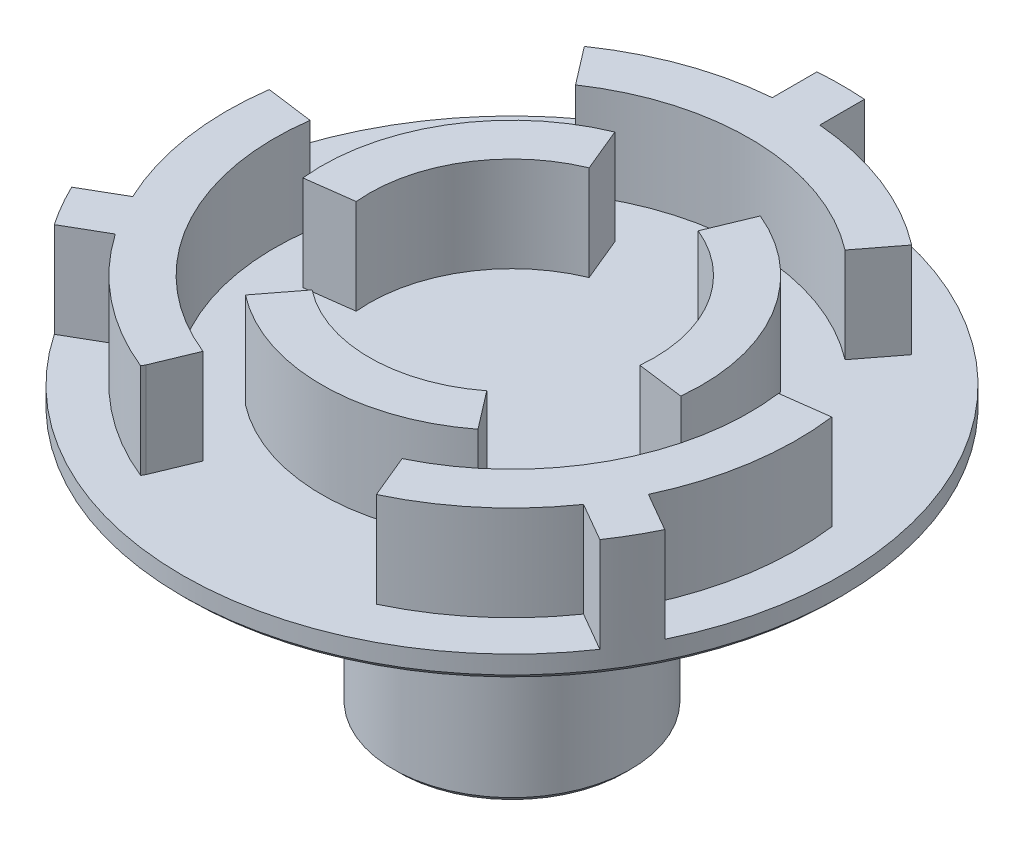
from build123d import *

# Parameters (mm, degrees)
SKETCH1_R           = 44.05249
BOSS_EXTRUDE1_DEPTH = 3.175
SKETCH2_R           = 15.875
BOSS_EXTRUDE2_DEPTH = 34.12998
SKETCH3_R           = 25.4
SKETCH3_R_2         = 19.05
BOSS_EXTRUDE3_DEPTH = 12.7
CUT_EXTRUDE2_DEPTH  = 73.614773175
CIRPATTERN1_COUNT   = 3
SKETCH5_R           = 38.1
SKETCH5_R_2         = 31.75
BOSS_EXTRUDE5_DEPTH = 12.7
CUT_EXTRUDE4_DEPTH  = 12.7
CIRPATTERN3_COUNT   = 3
BOSS_EXTRUDE6_DEPTH = 12.7
CIRPATTERN4_COUNT   = 3
SKETCH8_R           = 12.7
CUT_EXTRUDE5_DEPTH  = 34.12998
CHAMFER1_SIZE       = 0.762


with BuildPart() as part:
    # Sketch1 → Boss-Extrude1 (new body)
    with BuildSketch(Plane(origin=(0, 0, 0), x_dir=(1, 0, 0), z_dir=(0, 1, 0))):
        with Locations(Location((0, 0, 0), (0, 0, 270))):
            Circle(SKETCH1_R)
    extrude(amount=BOSS_EXTRUDE1_DEPTH)

    # Sketch2 → Boss-Extrude2 (add)
    with BuildSketch(Plane.XZ):
        with Locations(Location((0, 0, 0), (0, 0, 270))):
            Circle(SKETCH2_R)
    extrude(amount=BOSS_EXTRUDE2_DEPTH)

    # Sketch3 → Boss-Extrude3 (add)
    with BuildSketch(Plane(origin=(0, 3.175, 0), x_dir=(1, 0, 0), z_dir=(0, 1, 0))):
        with Locations(Location((0, 0, 0), (0, 0, 270))):
            Circle(SKETCH3_R)
        with Locations(Location((0, 0, 0), (0, 0, 270))):
            Circle(SKETCH3_R_2, mode=Mode.SUBTRACT)
    extrude(amount=BOSS_EXTRUDE3_DEPTH)

    # Sketch4 → Cut-Extrude2 (cut, through all)
    with BuildSketch(Plane(origin=(0, 3.175, 0), x_dir=(1, 0, 0), z_dir=(0, 1, 0))):
        Polygon((0, 0), (11.462134213, 27.672039871), (-12.066850466, 29.13195405), align=None)
    cut_extrude2 = extrude(amount=CUT_EXTRUDE2_DEPTH, mode=Mode.SUBTRACT)

    # CirPattern1: Cut-Extrude2 ×3 about axis
    cirpattern1_axis = Axis((0, 0, -0.454253878), (0, 1, 0))
    for i in range(1, CIRPATTERN1_COUNT):
        add(cut_extrude2.rotate(cirpattern1_axis, i * 360 / CIRPATTERN1_COUNT), mode=Mode.SUBTRACT)

    # Sketch5 → Boss-Extrude5 (add)
    with BuildSketch(Plane(origin=(0, 3.175, 0), x_dir=(1, 0, 0), z_dir=(0, 1, 0))):
        with Locations(Location((0, 0, 0), (0, 0, 270))):
            Circle(SKETCH5_R)
        with Locations(Location((0, 0, 0), (0, 0, 270))):
            Circle(SKETCH5_R_2, mode=Mode.SUBTRACT)
    extrude(amount=BOSS_EXTRUDE5_DEPTH)

    # Sketch6 → Cut-Extrude4 (cut)
    with BuildSketch(Plane(origin=(0, 15.875, 0), x_dir=(1, 0, 0), z_dir=(0, 1, 0))):
        Polygon((24.518856113, 31.953595399), (30.847960217, 40.201844455), (52.890000535, 5.212460302), (39.592566776, 5.212460302), (30.847960217, 4.061211008), (18.173239697, 23.68382708), align=None)
    cut_extrude4 = extrude(amount=-CUT_EXTRUDE4_DEPTH, mode=Mode.SUBTRACT)

    # CirPattern3: Cut-Extrude4 ×3 about axis
    cirpattern3_axis = Axis((1.188980204, 0, -0.687015275), (0, 1, 0))
    for i in range(1, CIRPATTERN3_COUNT):
        add(cut_extrude4.rotate(cirpattern3_axis, i * 360 / CIRPATTERN3_COUNT), mode=Mode.SUBTRACT)

    # Sketch7 → Boss-Extrude6 (add)
    with BuildSketch(Plane(origin=(0, 3.175, 0), x_dir=(1, 0, 0), z_dir=(0, 1, 0))):
        with BuildLine():
            Line((3.175, 35.86061982), (3.175, 43.937924965))
            ThreePointArc((3.175, 43.937924965), (0, 44.05249), (-3.175, 43.937924965))
            Line((-3.175, 43.937924965), (-3.175, 35.86061982))
            ThreePointArc((-3.175, 35.86061982), (0, 36.000898307), (3.175, 35.86061982))
        make_face()
    boss_extrude6 = extrude(amount=BOSS_EXTRUDE6_DEPTH)

    # CirPattern4: Boss-Extrude6 ×3 about axis
    cirpattern4_axis = Axis((0, 0, 0), (0, 1, 0))
    for i in range(1, CIRPATTERN4_COUNT):
        add(boss_extrude6.rotate(cirpattern4_axis, i * 360 / CIRPATTERN4_COUNT))

    # Sketch8 → Cut-Extrude5 (cut)
    with BuildSketch(Plane.XZ.offset(34.12998)):
        with Locations(Location((0, 0, 0), (0, 0, 270))):
            Circle(SKETCH8_R)
    extrude(amount=-CUT_EXTRUDE5_DEPTH, mode=Mode.SUBTRACT)

    # Chamfer1
    chamfer1_edges = [part.edges().sort_by_distance(p)[0] for p in [
        (0, 0, -44.05249),
        (0, -34.12998, 15.875),
    ]]
    chamfer(chamfer1_edges, length=CHAMFER1_SIZE)


solid = part.part
